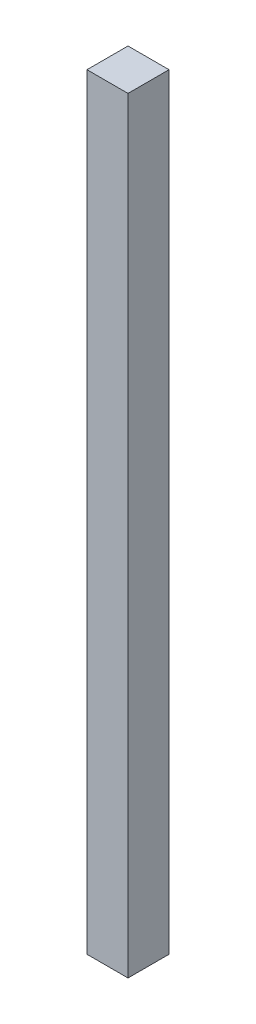
from build123d import *

# Parameters (mm, degrees)
SKETCH1_W           = 38.1
SKETCH1_H           = 38.1
BOSS_EXTRUDE1_DEPTH = 711.2


with BuildPart() as part:
    # Sketch1 → Boss-Extrude1 (new body)
    with BuildSketch(Plane(origin=(0, 0, 0), x_dir=(1, 0, 0), z_dir=(0, 1, 0))):
        Rectangle(SKETCH1_W, SKETCH1_H)
    extrude(amount=BOSS_EXTRUDE1_DEPTH)


solid = part.part
